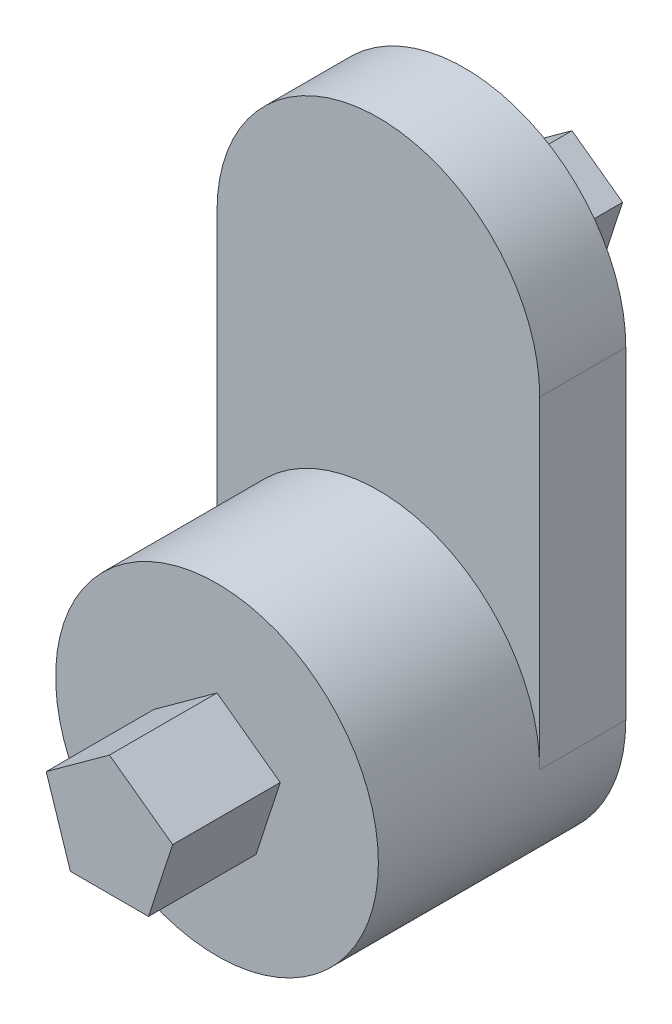
from build123d import *

# Parameters (mm, degrees)
SKETCH_5_R          = 15
EXTRUDE_5_DEPTH     = 25
SKETCH_6_R          = 10
SKETCH_6_R_2        = 15
EXTRUDE_6_DEPTH     = 8
SKETCH_8_R          = 7.5
EXTRUDE_7_DEPTH     = 5
SKETCH_16_R         = 15
CUT_EXTRUDE_1_DEPTH = 10
EXTRUDE_14_DEPTH    = 5


with BuildPart() as part:
    # 스케치5 → 보스-돌출5 (new body)
    with BuildSketch(Plane.XY):
        Circle(SKETCH_5_R)
    extrude(amount=-EXTRUDE_5_DEPTH)

    # 스케치6 → 보스-돌출6 (add)
    with BuildSketch(Plane(origin=(0, 0, -25), x_dir=(-1, 0, 0), z_dir=(0, 0, -1))):
        with BuildLine():
            ThreePointArc((-15, 0), (0, -15), (15, 0))
            Line((15, 0), (-15, 0))
        make_face()
        with BuildLine():
            Line((-15, 0), (15, 0))
            ThreePointArc((15, 0), (0, 15), (-15, 0))
        make_face()
        with BuildLine():
            ThreePointArc((-15, 0), (0, 15), (15, 0))
            Line((15, 0), (15, 30))
            Line((15, 30), (10, 30))
            ThreePointArc((10, 30), (0, 20), (-10, 30))
            Line((-10, 30), (-15, 30))
            Line((-15, 30), (-15, 0))
        make_face()
        with Locations((0, 30)):
            Circle(SKETCH_6_R)
        with BuildLine():
            Line((15, 30), (-15, 30))
            ThreePointArc((-15, 30), (0, 45), (15, 30))
        make_face()
        with Locations(Location((0, 0, 0), (0, 0, 180))):
            Circle(SKETCH_6_R_2)
    extrude(amount=EXTRUDE_6_DEPTH)

    # 스케치8 → 보스-돌출7 (add)
    with BuildSketch(Plane(origin=(0, 0, -33), x_dir=(-1, 0, 0), z_dir=(0, 0, -1))):
        with Locations((0, 30)):
            Circle(SKETCH_8_R)
    extrude(amount=EXTRUDE_7_DEPTH)

    # 스케치16 → 컷-돌출1 (cut)
    with BuildSketch(Plane.XY):
        Circle(SKETCH_16_R)
        Polygon((0, 6.180339887), (-5.877852523, 1.909830056), (-3.63271264, -5), (3.63271264, -5), (5.877852523, 1.909830056), align=None, mode=Mode.SUBTRACT)
    extrude(amount=-CUT_EXTRUDE_1_DEPTH, mode=Mode.SUBTRACT)

    # 스케치19 → 보스-돌출14 (add)
    with BuildSketch(Plane(origin=(0, 0, -38), x_dir=(-1, 0, 0), z_dir=(0, 0, -1))):
        Polygon((0, 34.94427191), (-4.702282018, 31.527864045), (-2.906170112, 26), (2.906170112, 26), (4.702282018, 31.527864045), align=None)
    extrude(amount=EXTRUDE_14_DEPTH)


solid = part.part
